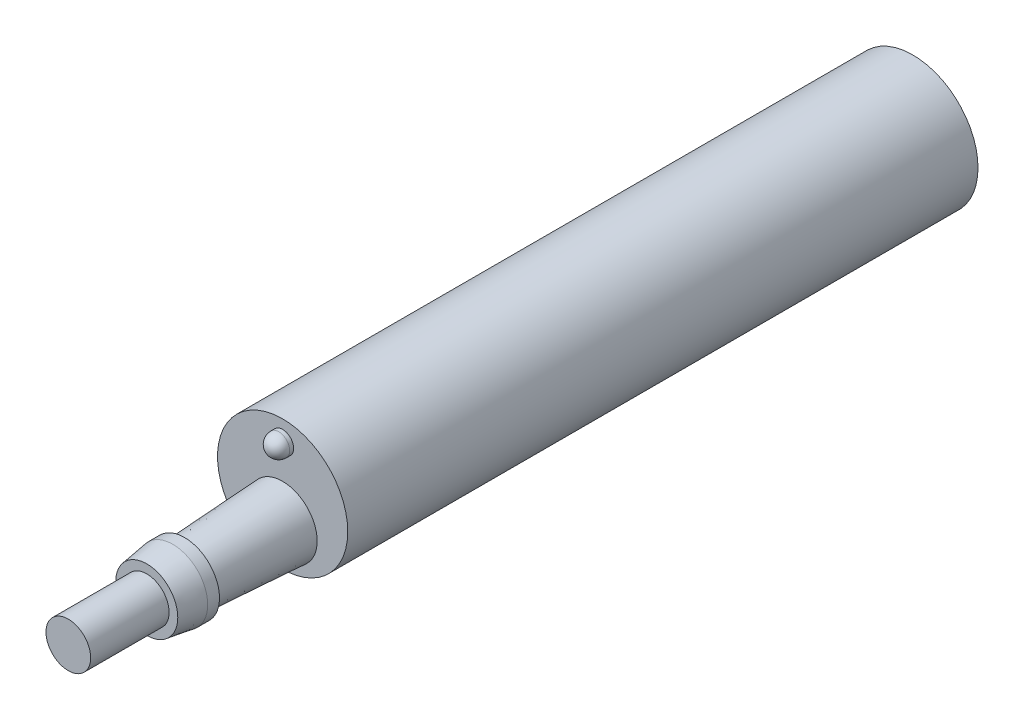
from build123d import *

# Parameters (mm, degrees)
SKETCH1_R           = 8.3
BOSS_EXTRUDE1_DEPTH = 80.34
SKETCH2_R           = 1.4
BOSS_EXTRUDE2_DEPTH = 0.5
DOME1_FACE_RADIUS   = 1.4
DOME1_HEIGHT        = 1.4
SKETCH3_R           = 4.4
BOSS_EXTRUDE3_DEPTH = 12.5
BOSS_EXTRUDE3_TAPER = 3.2
SKETCH4_R           = 4.45
BOSS_EXTRUDE4_DEPTH = 1.5
SKETCH5_R           = 4.45
BOSS_EXTRUDE5_DEPTH = 3.32
BOSS_EXTRUDE5_TAPER = 8.5
SKETCH6_R           = 2.85
BOSS_EXTRUDE6_DEPTH = 10


with BuildPart() as part:
    # Sketch1 → Boss-Extrude1 (new body)
    with BuildSketch(Plane.XY):
        Circle(SKETCH1_R)
    extrude(amount=BOSS_EXTRUDE1_DEPTH)

    # Sketch2 → Boss-Extrude2 (add)
    with BuildSketch(Plane.XY.offset(80.34)):
        with Locations((0, 5.73)):
            Circle(SKETCH2_R)
    extrude(amount=BOSS_EXTRUDE2_DEPTH)

    # Dome1: a dome of height H over a round flat face of radius A is a cap of a sphere of radius (A * A + H * H) / (2 * H)
    dome1_r = (DOME1_FACE_RADIUS * DOME1_FACE_RADIUS + DOME1_HEIGHT * DOME1_HEIGHT) / (2 * DOME1_HEIGHT)
    dome1_base = Plane((0, 5.73, 80.84), z_dir=(0, 0, 1))
    with Locations(dome1_base.offset(DOME1_HEIGHT - dome1_r)):
        dome1_ball = Sphere(dome1_r, mode=Mode.PRIVATE)
    add(split(dome1_ball, bisect_by=dome1_base, keep=Keep.TOP, mode=Mode.PRIVATE))

    # Sketch3 → Boss-Extrude3 (add)
    with BuildSketch(Plane.XY.offset(80.34)):
        with Locations((0, -3)):
            Circle(SKETCH3_R)
    extrude(amount=BOSS_EXTRUDE3_DEPTH, taper=BOSS_EXTRUDE3_TAPER)

    # Sketch4 → Boss-Extrude4 (add)
    with BuildSketch(Plane.XY.offset(92.84)):
        with Locations((0, -3)):
            Circle(SKETCH4_R)
    extrude(amount=BOSS_EXTRUDE4_DEPTH)

    # Sketch5 → Boss-Extrude5 (add)
    with BuildSketch(Plane.XY.offset(94.34)):
        with Locations((0, -3)):
            Circle(SKETCH5_R)
    extrude(amount=BOSS_EXTRUDE5_DEPTH, taper=BOSS_EXTRUDE5_TAPER)

    # Sketch6 → Boss-Extrude6 (add)
    with BuildSketch(Plane.XY.offset(97.66)):
        with Locations((0, -3)):
            Circle(SKETCH6_R)
    extrude(amount=BOSS_EXTRUDE6_DEPTH)


solid = part.part
